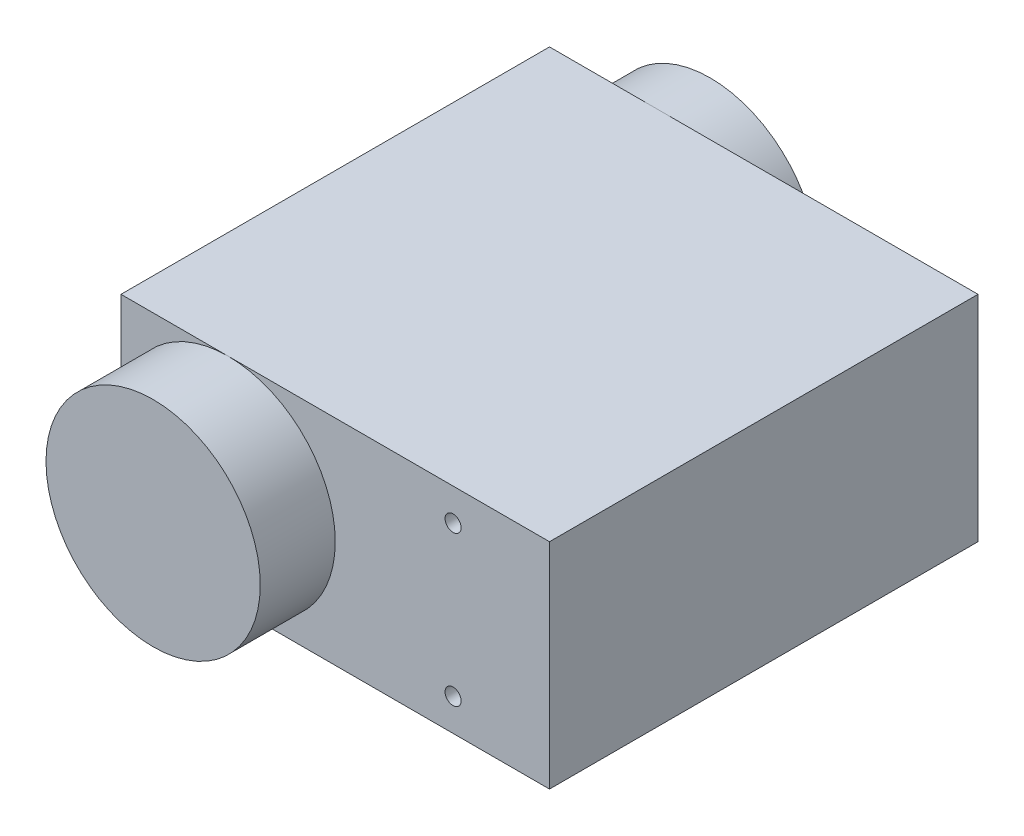
from build123d import *

# Parameters (mm, degrees)
SKETCH_1_W           = 40
SKETCH_1_H           = 40
EXTRUDE_1_DEPTH      = 20
EXTRUDE_2_DEPTH      = 7
EXTRUDE_2_DEPTH_BACK = 45
SKETCH_2_R           = 10
SKETCH_3_R           = 0.75
CUT_EXTRUDE_1_DEPTH  = 3


with BuildPart() as part:
    # 草图1 → 凸台-拉伸1 (new body)
    with BuildSketch(Plane(origin=(0, 0, 0), x_dir=(1, 0, 0), z_dir=(0, 1, 0))):
        with Locations((20, -20)):
            Rectangle(SKETCH_1_W, SKETCH_1_H)
    extrude(amount=EXTRUDE_1_DEPTH)

    # 草图2 → 凸台-拉伸2 (add, two sides: drawn at the far end of the back side and taken through both)
    with BuildSketch(Plane.XY.offset(40).offset(-EXTRUDE_2_DEPTH_BACK)):
        with Locations((10, 10)):
            Circle(SKETCH_2_R)
    extrude(amount=EXTRUDE_2_DEPTH + EXTRUDE_2_DEPTH_BACK)

    # 草图3 → 切除-拉伸1 (cut)
    with BuildSketch(Plane.XY.offset(40)):
        with Locations((31, 17)):
            Circle(SKETCH_3_R)
        with Locations((31, 3)):
            Circle(SKETCH_3_R)
    extrude(amount=-CUT_EXTRUDE_1_DEPTH, mode=Mode.SUBTRACT)


solid = part.part
